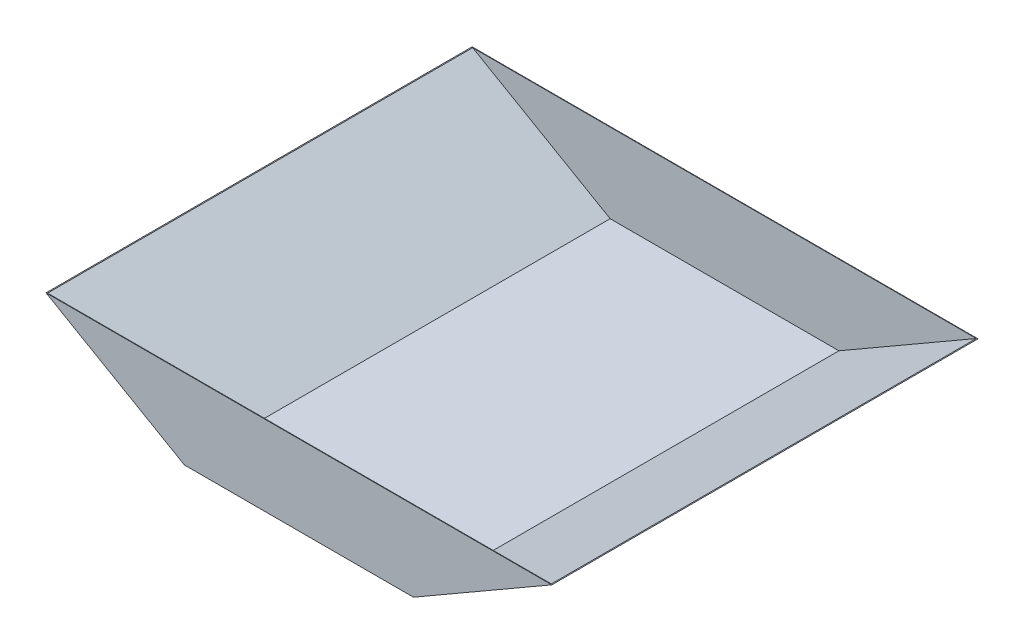
from build123d import *

# Parameters (mm, degrees)
BOSS_EXTRUDE1_DEPTH = 800
SHELL1_T            = -1


with BuildPart() as part:
    # Sketch1 → Boss-Extrude1 (new body)
    with BuildSketch(Plane.XY):
        Polygon((-978.315410822, 0), (-548.315410822, 0), (-288.507789686, 150), (-1238.123031957, 150), align=None)
    extrude(amount=BOSS_EXTRUDE1_DEPTH)

    # Shell1
    shell1_openings = [part.faces().sort_by_distance(p)[0] for p in [
        (-763.315410822, 150, 400),
    ]]
    offset(amount=SHELL1_T, openings=shell1_openings, kind=Kind.INTERSECTION)


solid = part.part
